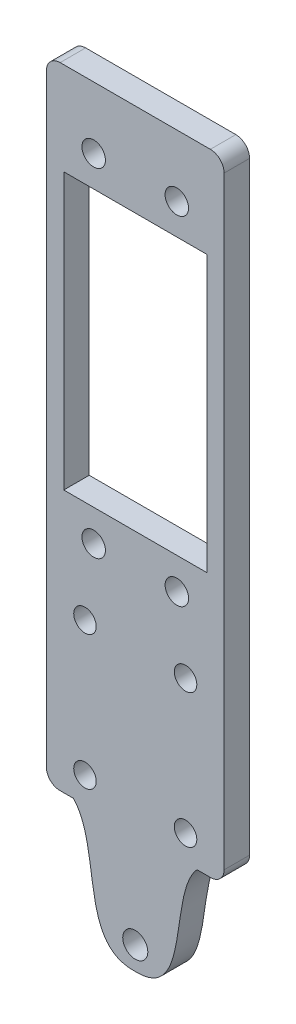
from build123d import *

# Parameters (mm, degrees)
SKETCH1_R           = 1.869394483
SKETCH1_R_2         = 1.6775
SKETCH1_R_3         = 1.75
SKETCH1_W           = 21.327694626
SKETCH1_H           = 41.102200046
BOSS_EXTRUDE1_DEPTH = 3.8


with BuildPart() as part:
    # Sketch1 → Boss-Extrude1 (new body)
    with BuildSketch(Plane.XY):
        with BuildLine():
            Line((8.585, -14.879916086), (10.629231235, -14.879916086))
            add(Edge.make_bspline(
                [(10.629231235, -14.879916086), (14.945689429, -19.598266914), (11.330822281, -32.912320887), (19.835, -32.631980139)],
                knots=[0, 0, 0, 0, 1, 1, 1, 1], degree=3))
            add(Edge.make_bspline(
                [(29.040768765, -14.879916086), (24.724310571, -19.598266914), (28.339177719, -32.912320887), (19.835, -32.631980139)],
                knots=[0, 0, 0, 0, 1, 1, 1, 1], degree=3))
            Line((29.040768765, -14.879916086), (31.085, -14.879916086))
            ThreePointArc((31.085, -14.879916086), (32.499213562, -14.294129648), (33.085, -12.879916086))
            Line((33.085, -12.879916086), (33.085, 77.107681283))
            ThreePointArc((33.085, 77.107681283), (32.484733836, 78.556851998), (31.035563121, 79.157118162))
            Line((31.035563121, 79.157118162), (8.634436879, 79.157118162))
            ThreePointArc((8.634436879, 79.157118162), (7.185266164, 78.556851998), (6.585, 77.107681283))
            Line((6.585, 77.107681283), (6.585, -12.879916086))
            ThreePointArc((6.585, -12.879916086), (7.170786438, -14.294129648), (8.585, -14.879916086))
        make_face()
        with Locations(Location((19.835, -29.181539917, 0), (0, 0, 180))):
            Circle(SKETCH1_R, mode=Mode.SUBTRACT)
        with Locations(Location((12.335, 9, 0), (0, 0, 180))):
            Circle(SKETCH1_R_2, mode=Mode.SUBTRACT)
        with Locations(Location((12.335, -11, 0), (0, 0, 180))):
            Circle(SKETCH1_R_2, mode=Mode.SUBTRACT)
        with Locations(Location((27.335, 9, 0), (0, 0, 180))):
            Circle(SKETCH1_R_2, mode=Mode.SUBTRACT)
        with Locations(Location((27.335, -11, 0), (0, 0, 180))):
            Circle(SKETCH1_R_2, mode=Mode.SUBTRACT)
        with Locations(Location((26.035, 69.924718691, 0), (0, 0, 180))):
            Circle(SKETCH1_R_3, mode=Mode.SUBTRACT)
        with Locations(Location((13.635, 69.924718691, 0), (0, 0, 180))):
            Circle(SKETCH1_R_3, mode=Mode.SUBTRACT)
        with Locations(Location((13.635, 19.524718691, 0), (0, 0, 180))):
            Circle(SKETCH1_R_3, mode=Mode.SUBTRACT)
        with Locations(Location((26.035, 19.524718691, 0), (0, 0, 180))):
            Circle(SKETCH1_R_3, mode=Mode.SUBTRACT)
        with Locations((19.835, 44.774489529)):
            Rectangle(SKETCH1_W, SKETCH1_H, mode=Mode.SUBTRACT)
    extrude(amount=BOSS_EXTRUDE1_DEPTH)


solid = part.part
